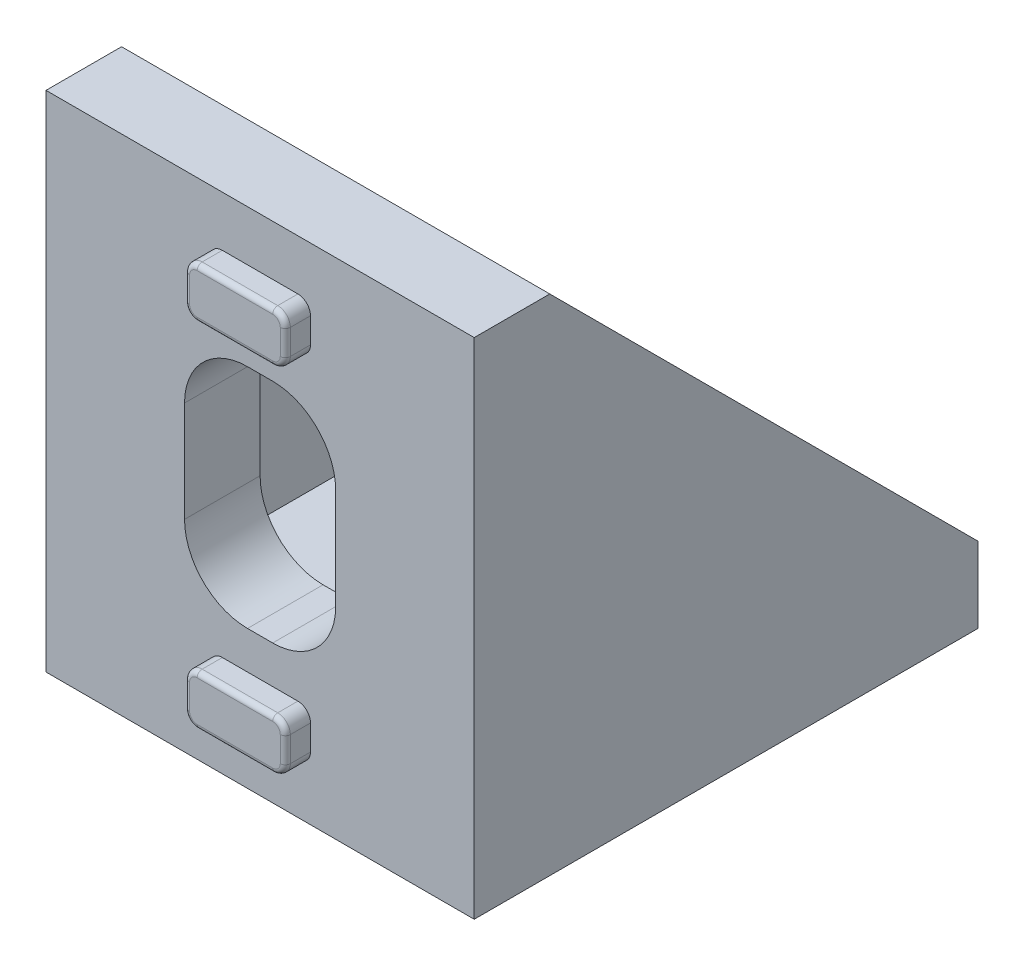
from build123d import *

# Parameters (mm, degrees)
SKETCH1_W           = 17
SKETCH1_H           = 20
BOSS_EXTRUDE1_DEPTH = 3
SKETCH2_W           = 17
SKETCH2_H           = 3
BOSS_EXTRUDE2_DEPTH = 17
RIB1_REACH          = 30.089
SKETCH3_WALL_W      = 82.219918182
SKETCH3_WALL_H      = 2
RIB4_REACH          = 30.089
SKETCH4_WALL_W      = 82.219918182
SKETCH4_WALL_H      = 2
CUT_EXTRUDE1_DEPTH  = 17
CUT_EXTRUDE2_DEPTH  = 17
BOSS_EXTRUDE3_DEPTH = 1
BOSS_EXTRUDE4_DEPTH = 1
FILLET1_R           = 0.2


with BuildPart() as part:
    # Sketch1 → Boss-Extrude1 (new body)
    with BuildSketch(Plane(origin=(0, 0, 0), x_dir=(1, 0, 0), z_dir=(0, 1, 0))):
        Rectangle(SKETCH1_W, SKETCH1_H)
    extrude(amount=BOSS_EXTRUDE1_DEPTH)

    # Sketch2 → Boss-Extrude2 (add)
    with BuildSketch(Plane(origin=(0, 3, 0), x_dir=(1, 0, 0), z_dir=(0, 1, 0))):
        with Locations((0, -8.5)):
            Rectangle(SKETCH2_W, SKETCH2_H)
    extrude(amount=BOSS_EXTRUDE2_DEPTH)

    # Sketch3 wall → Rib1 (add, up to next)
    with BuildSketch(Plane(origin=(8.5, 11.5, -1.5), x_dir=(0, -0.707106781187, -0.707106781187), z_dir=(0, 0.707106781187, -0.707106781187)), mode=Mode.PRIVATE) as rib1_sk1:
        with Locations((0, 1)):
            Rectangle(SKETCH3_WALL_W, SKETCH3_WALL_H)
    rib1_tool1 = extrude(rib1_sk1.sketch, amount=-RIB1_REACH, mode=Mode.PRIVATE) - part.part
    add(rib1_tool1.solids().sort_by_distance((8.5, 11.5, -1.5))[0])

    # Sketch4 wall → Rib4 (add, up to next)
    with BuildSketch(Plane(origin=(-8.5, 11.5, -1.5), x_dir=(0, -0.707106781187, -0.707106781187), z_dir=(0, -0.707106781187, 0.707106781187)), mode=Mode.PRIVATE) as rib4_sk1:
        with Locations((0, 1)):
            Rectangle(SKETCH4_WALL_W, SKETCH4_WALL_H)
    rib4_tool1 = extrude(rib4_sk1.sketch, amount=RIB4_REACH, mode=Mode.PRIVATE) - part.part
    add(rib4_tool1.solids().sort_by_distance((-8.5, 11.5, -1.5))[0])

    # Sketch5 → Cut-Extrude1 (cut)
    with BuildSketch(Plane.XY.offset(10)):
        with BuildLine():
            Line((-0.5, 5.5), (0.5, 5.5))
            ThreePointArc((0.5, 5.5), (2.267766953, 6.232233047), (3, 8))
            Line((3, 8), (3, 12))
            ThreePointArc((3, 12), (2.267766953, 13.767766953), (0.5, 14.5))
            Line((0.5, 14.5), (-0.5, 14.5))
            ThreePointArc((-0.5, 14.5), (-2.267766953, 13.767766953), (-3, 12))
            Line((-3, 12), (-3, 8))
            ThreePointArc((-3, 8), (-2.267766953, 6.232233047), (-0.5, 5.5))
        make_face()
    extrude(amount=-CUT_EXTRUDE1_DEPTH, mode=Mode.SUBTRACT)

    # Sketch6 → Cut-Extrude2 (cut)
    with BuildSketch(Plane.XZ):
        with BuildLine():
            Line((-0.5, 4.5), (0.5, 4.5))
            ThreePointArc((0.5, 4.5), (2.267766953, 3.767766953), (3, 2))
            Line((3, 2), (3, -2))
            ThreePointArc((3, -2), (2.267766953, -3.767766953), (0.5, -4.5))
            Line((0.5, -4.5), (-0.5, -4.5))
            ThreePointArc((-0.5, -4.5), (-2.267766953, -3.767766953), (-3, -2))
            Line((-3, -2), (-3, 2))
            ThreePointArc((-3, 2), (-2.267766953, 3.767766953), (-0.5, 4.5))
        make_face()
    extrude(amount=-CUT_EXTRUDE2_DEPTH, mode=Mode.SUBTRACT)

    # Sketch7 → Boss-Extrude3 (add)
    with BuildSketch(Plane.XZ):
        with BuildLine():
            Line((1.5, 8), (-1.5, 8))
            ThreePointArc((-1.5, 8), (-1.853553391, 7.853553391), (-2, 7.5))
            Line((-2, 7.5), (-2, 6.5))
            ThreePointArc((-2, 6.5), (-1.853553391, 6.146446609), (-1.5, 6))
            Line((-1.5, 6), (1.5, 6))
            ThreePointArc((1.5, 6), (1.853553391, 6.146446609), (2, 6.5))
            Line((2, 6.5), (2, 7.5))
            ThreePointArc((2, 7.5), (1.853553391, 7.853553391), (1.5, 8))
        make_face()
        with BuildLine():
            Line((-2, -7.5), (-2, -6.5))
            ThreePointArc((-2, -6.5), (-1.853553391, -6.146446609), (-1.5, -6))
            Line((-1.5, -6), (1.5, -6))
            ThreePointArc((1.5, -6), (1.853553391, -6.146446609), (2, -6.5))
            Line((2, -6.5), (2, -7.5))
            ThreePointArc((2, -7.5), (1.853553391, -7.853553391), (1.5, -8))
            Line((1.5, -8), (-1.5, -8))
            ThreePointArc((-1.5, -8), (-1.853553391, -7.853553391), (-2, -7.5))
        make_face()
    extrude(amount=BOSS_EXTRUDE3_DEPTH)

    # Sketch8 → Boss-Extrude4 (add)
    with BuildSketch(Plane.XY.offset(10)):
        with BuildLine():
            Line((-1.5, 4), (1.5, 4))
            ThreePointArc((1.5, 4), (1.853553391, 3.853553391), (2, 3.5))
            Line((2, 3.5), (2, 2.5))
            ThreePointArc((2, 2.5), (1.853553391, 2.146446609), (1.5, 2))
            Line((1.5, 2), (-1.5, 2))
            ThreePointArc((-1.5, 2), (-1.853553391, 2.146446609), (-2, 2.5))
            Line((-2, 2.5), (-2, 3.5))
            ThreePointArc((-2, 3.5), (-1.853553391, 3.853553391), (-1.5, 4))
        make_face()
        with BuildLine():
            Line((2, 16.5), (2, 17.5))
            ThreePointArc((2, 17.5), (1.853553391, 17.853553391), (1.5, 18))
            Line((1.5, 18), (-1.5, 18))
            ThreePointArc((-1.5, 18), (-1.853553391, 17.853553391), (-2, 17.5))
            Line((-2, 17.5), (-2, 16.5))
            ThreePointArc((-2, 16.5), (-1.853553391, 16.146446609), (-1.5, 16))
            Line((-1.5, 16), (1.5, 16))
            ThreePointArc((1.5, 16), (1.853553391, 16.146446609), (2, 16.5))
        make_face()
    extrude(amount=BOSS_EXTRUDE4_DEPTH)

    # Fillet1
    fillet1_edges = [part.edges().sort_by_distance(p)[0] for p in [
        (-1.853553391, -1, 7.853553391),
        (-2, -1, 7),
        (-1.853553391, -1, 6.146446609),
        (0, -1, 6),
        (1.853553391, -1, 6.146446609),
        (2, -1, 7),
        (1.853553391, -1, 7.853553391),
        (0, -1, 8),
        (1.853553391, -1, -7.853553391),
        (2, -1, -7),
        (1.853553391, -1, -6.146446609),
        (0, -1, -6),
        (-1.853553391, -1, -6.146446609),
        (-2, -1, -7),
        (-1.853553391, -1, -7.853553391),
        (0, -1, -8),
        (-1.853553391, 3.853553391, 11),
        (-2, 3, 11),
        (-1.853553391, 2.146446609, 11),
        (0, 2, 11),
        (1.853553391, 2.146446609, 11),
        (2, 3, 11),
        (1.853553391, 3.853553391, 11),
        (0, 4, 11),
        (1.853553391, 16.146446609, 11),
        (2, 17, 11),
        (1.853553391, 17.853553391, 11),
        (0, 18, 11),
        (-1.853553391, 17.853553391, 11),
        (-2, 17, 11),
        (-1.853553391, 16.146446609, 11),
        (0, 16, 11),
    ]]
    fillet(fillet1_edges, radius=FILLET1_R)


solid = part.part
